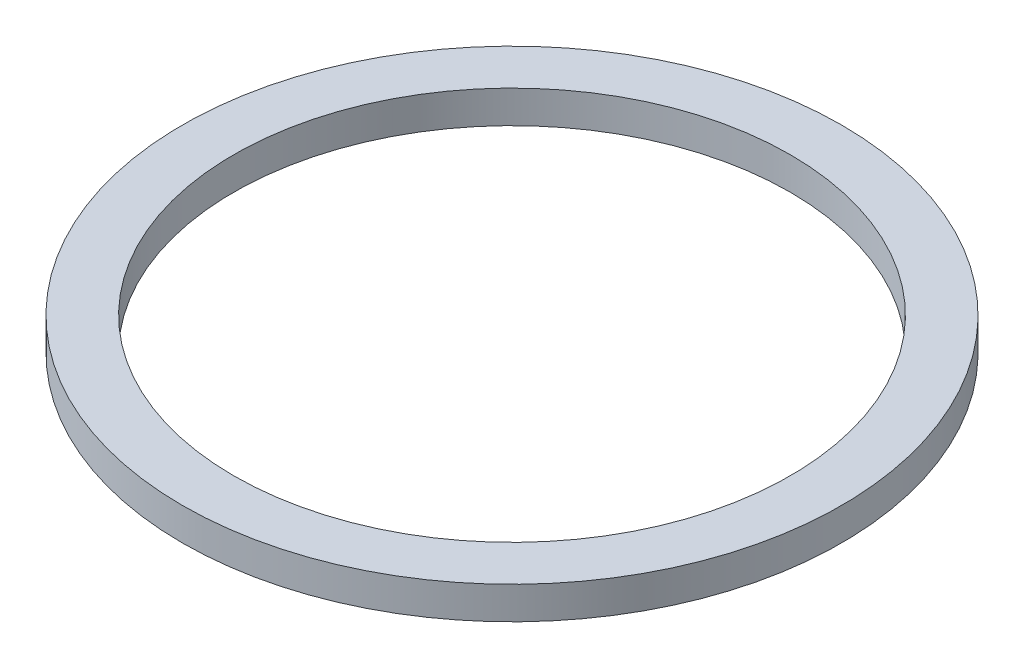
from build123d import *

# Parameters (mm, degrees)
SKETCH1_R           = 192.5
SKETCH1_R_2         = 162.5
BOSS_EXTRUDE1_DEPTH = 9.5


with BuildPart() as part:
    # Sketch1 → Boss-Extrude1 (new, symmetric)
    with BuildSketch(Plane(origin=(0, 0, 0), x_dir=(1, 0, 0), z_dir=(0, 1, 0))):
        with Locations(Location((0, 0, 0), (0, 0, 270))):
            Circle(SKETCH1_R)
        with Locations(Location((0, 0, 0), (0, 0, 270))):
            Circle(SKETCH1_R_2, mode=Mode.SUBTRACT)
    extrude(amount=BOSS_EXTRUDE1_DEPTH, both=True)


solid = part.part
